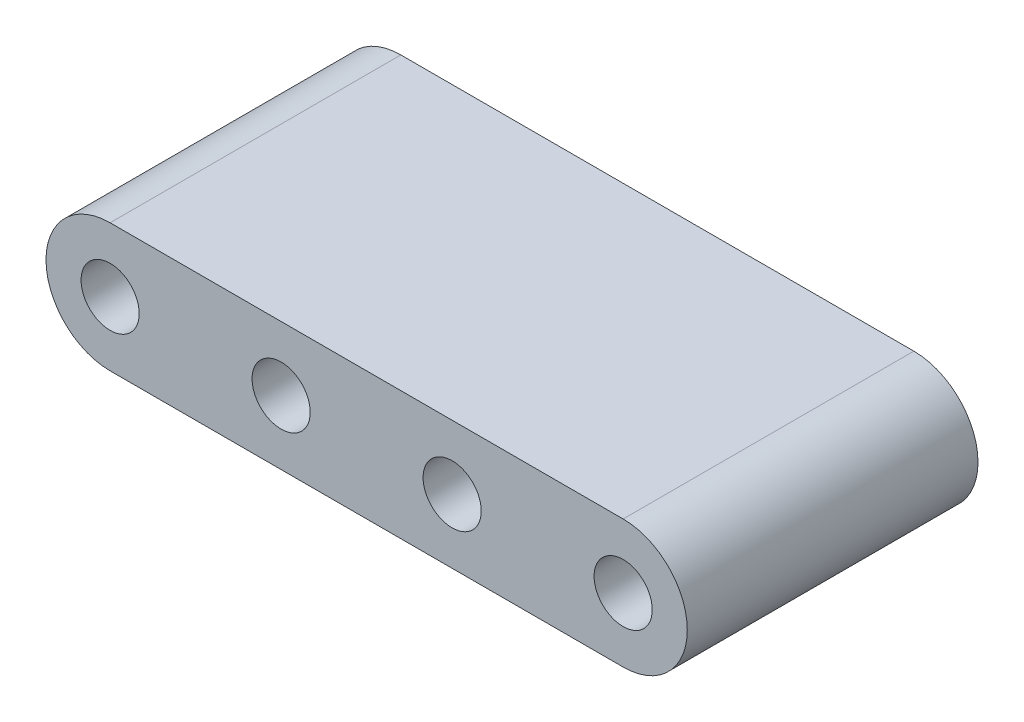
from build123d import *

# Parameters (mm, degrees)
SKETCH_1_R      = 3.4
EXTRUDE_1_DEPTH = 34


with BuildPart() as part:
    # 草图1 → 凸台-拉伸1 (new body)
    with BuildSketch(Plane.XY):
        with BuildLine():
            Line((0, 7.5), (60, 7.5))
            ThreePointArc((60, 7.5), (67.5, 0), (60, -7.5))
            Line((60, -7.5), (0, -7.5))
            ThreePointArc((0, -7.5), (-7.5, 0), (0, 7.5))
        make_face()
        Circle(SKETCH_1_R, mode=Mode.SUBTRACT)
        with Locations((20, 0)):
            Circle(SKETCH_1_R, mode=Mode.SUBTRACT)
        with Locations((40, 0)):
            Circle(SKETCH_1_R, mode=Mode.SUBTRACT)
        with Locations((60, 0)):
            Circle(SKETCH_1_R, mode=Mode.SUBTRACT)
    extrude(amount=EXTRUDE_1_DEPTH)


solid = part.part
